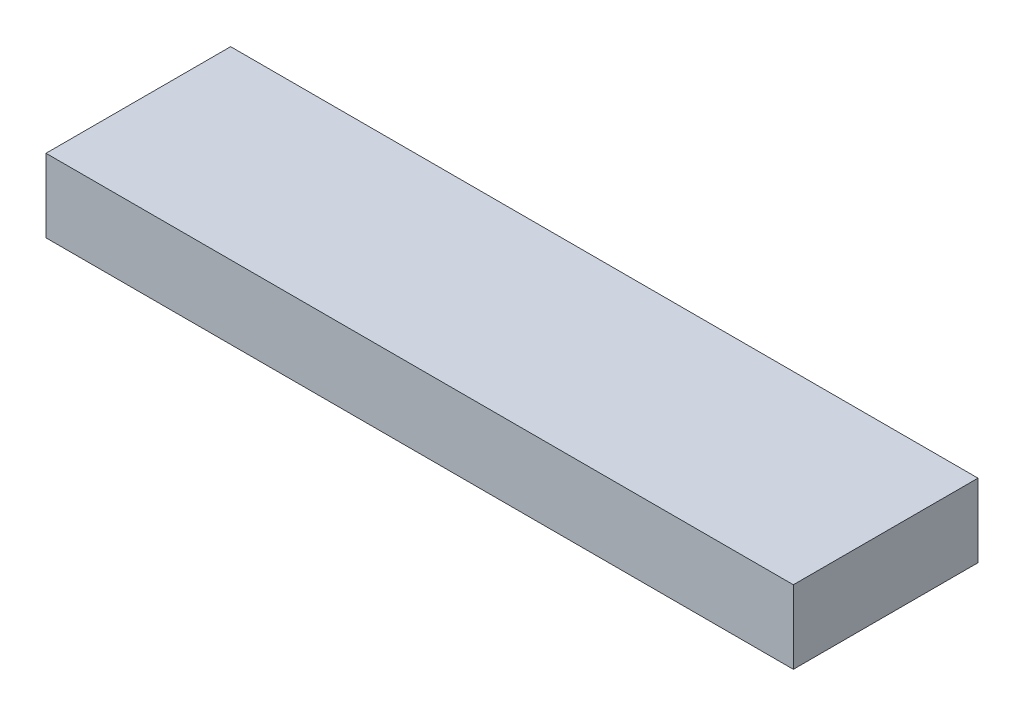
from build123d import *

# Parameters (mm, degrees)
SKETCH1_W           = 129.54
SKETCH1_H           = 32.004
BOSS_EXTRUDE1_DEPTH = 12.7


with BuildPart() as part:
    # Sketch1 → Boss-Extrude1 (new body)
    with BuildSketch(Plane(origin=(0, 0, 0), x_dir=(1, 0, 0), z_dir=(0, 1, 0))):
        Rectangle(SKETCH1_W, SKETCH1_H)
    extrude(amount=BOSS_EXTRUDE1_DEPTH)


solid = part.part
